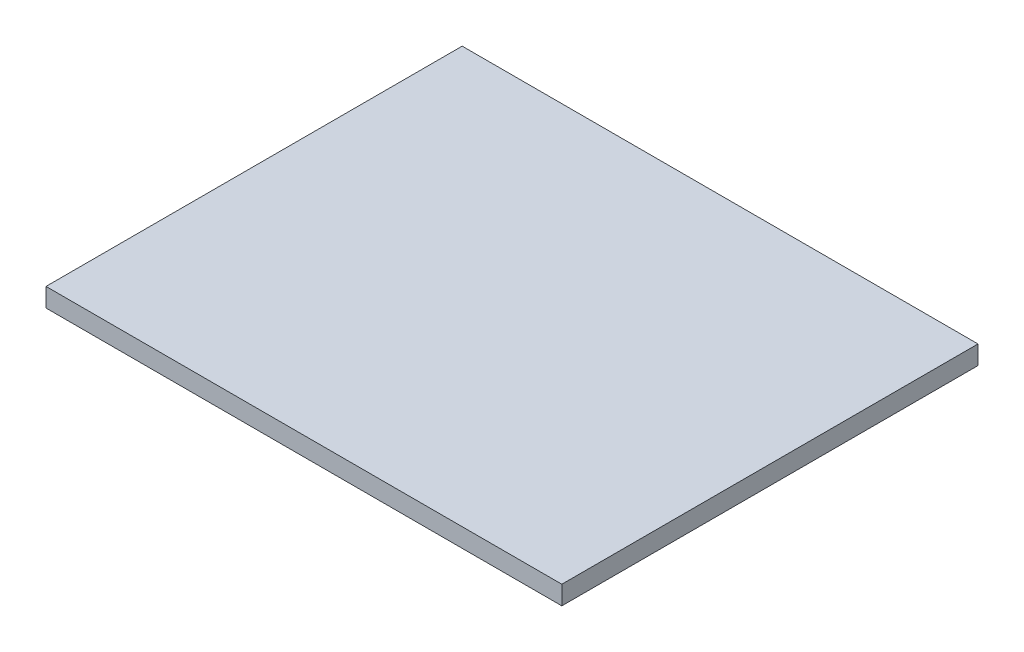
from build123d import *

# Parameters (mm, degrees)
SKETCH_1_W      = 44
SKETCH_1_H      = 35.5
EXTRUDE_1_DEPTH = 1.6


with BuildPart() as part:
    # 草图1 → 凸台-拉伸1 (new body)
    with BuildSketch(Plane(origin=(0, 0, 0), x_dir=(1, 0, 0), z_dir=(0, 1, 0))):
        Rectangle(SKETCH_1_W, SKETCH_1_H)
    extrude(amount=EXTRUDE_1_DEPTH)


solid = part.part
